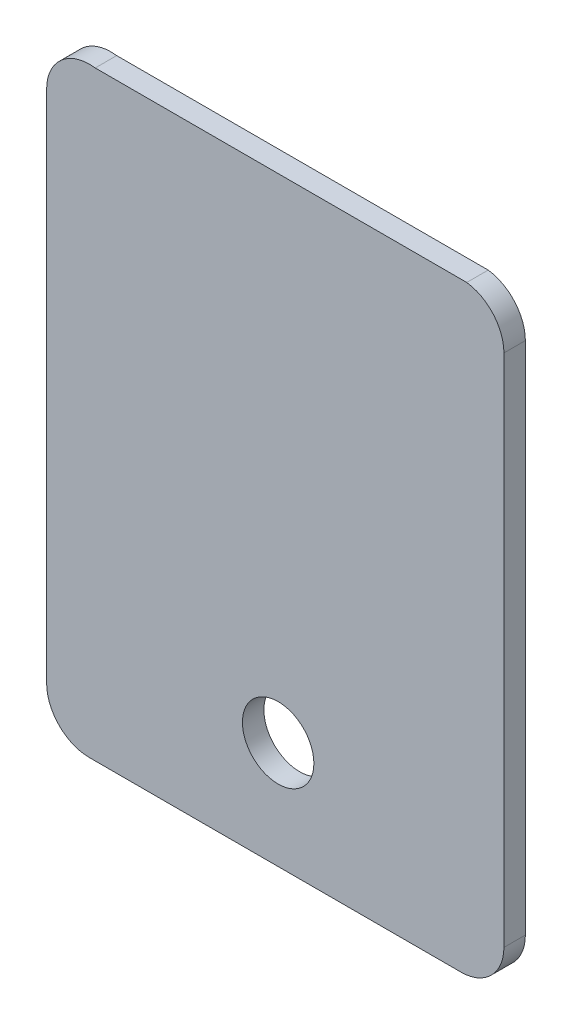
from build123d import *

# Parameters (mm, degrees)
EXTRUDE_1_DEPTH     = 1.5
SKETCH_2_R          = 2.5
CUT_EXTRUDE_1_DEPTH = 171.705927088


with BuildPart() as part:
    # Эскиз1 → Бобышка-Вытянуть1 (new body)
    with BuildSketch(Plane.XY):
        with BuildLine():
            Line((-160.546924203, 6.867662583), (-134.546924203, 6.867662583))
            ThreePointArc((-134.546924203, 6.867662583), (-132.42560386, 7.746342239), (-131.546924203, 9.867662583))
            Line((-131.546924203, 9.867662583), (-131.546924203, 45.894448833))
            ThreePointArc((-131.546924203, 45.894448833), (-132.288606245, 47.869290599), (-134.146924203, 48.867662583))
            Line((-134.146924203, 48.867662583), (-160.146924203, 48.867662583))
            ThreePointArc((-160.146924203, 48.867662583), (-162.521765969, 48.152766791), (-163.546924203, 45.894448833))
            Line((-163.546924203, 45.894448833), (-163.546924203, 9.867662583))
            ThreePointArc((-163.546924203, 9.867662583), (-162.668244547, 7.746342239), (-160.546924203, 6.867662583))
        make_face()
    extrude(amount=EXTRUDE_1_DEPTH)

    # Эскиз2 → Вырез-Вытянуть1 (cut, through all)
    with BuildSketch(Plane.XY.offset(1.5)):
        with Locations((-147.346924203, 14.367662583)):
            Circle(SKETCH_2_R)
    extrude(amount=-CUT_EXTRUDE_1_DEPTH, mode=Mode.SUBTRACT)


solid = part.part
